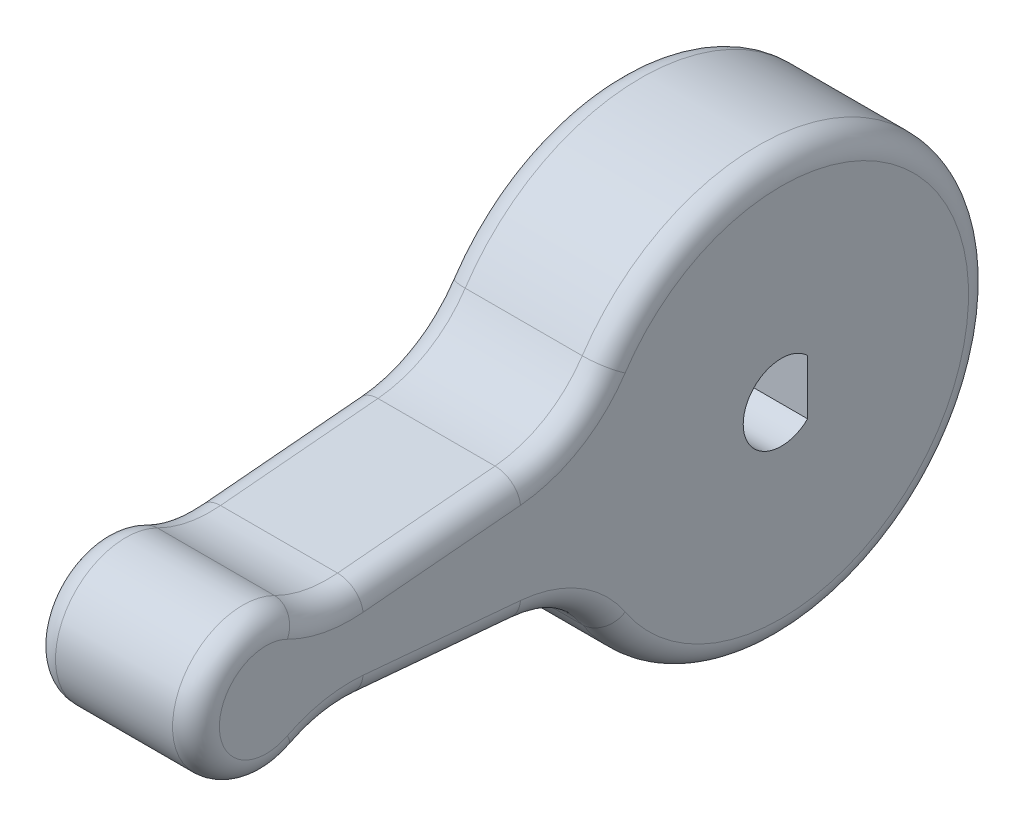
from build123d import *

# Parameters (mm, degrees)
BOSS_EXTRUDE1_DEPTH = 3.5
FILLET1_R           = 5
HOLE1_D             = 2.5
HOLE1_DEPTH         = 9
HOLE1_CBORE_D       = 3.5
HOLE1_CBORE_DEPTH   = 3
FILLET2_R           = 1


with BuildPart() as part:
    # Sketch1 → Boss-Extrude1 (new, symmetric)
    with BuildSketch(Plane(origin=(0, 0, 0), x_dir=(0, 0, -1), z_dir=(1, 0, 0))):
        with BuildLine():
            Line((-19.763932023, 2), (-8.485281374, 3))
            ThreePointArc((-8.485281374, 3), (9, 0), (-8.485281374, -3))
            Line((-8.485281374, -3), (-19.763932023, -2))
            ThreePointArc((-19.763932023, -2), (-25, 0), (-19.763932023, 2))
        make_face()
        with BuildLine():
            Line((1.125, -1.17260394), (1.125, 1.17260394))
            ThreePointArc((1.125, 1.17260394), (-1.625, 0), (1.125, -1.17260394))
        make_face(mode=Mode.SUBTRACT)
    extrude(amount=BOSS_EXTRUDE1_DEPTH, both=True)

    # Fillet1
    fillet1_edges = [part.edges().sort_by_distance(p)[0] for p in [
        (0, 2, 19.763932023),
        (0, 3, 8.485281374),
        (0, -3, 8.485281374),
        (0, -2, 19.763932023),
    ]]
    fillet(fillet1_edges, radius=FILLET1_R)

    # Hole1
    with Locations(Plane(origin=(0, 0, -9.125), x_dir=(1, 0, 0), z_dir=(0, 0, -1))):
        with Locations((0, 0)):
            CounterBoreHole(HOLE1_D / 2, HOLE1_CBORE_D / 2, HOLE1_CBORE_DEPTH, depth=HOLE1_DEPTH)

    # Fillet2
    fillet2_edges = [part.edges().sort_by_distance(p)[0] for p in [
        (-3.5, 0, 25),
        (3.5, 0, 25),
        (-3.5, 2.458817952, 14.589084631),
        (3.5, 2.458817952, 14.589084631),
        (-3.5, 0, -9),
        (3.5, 0, -9),
        (-3.5, -2.458817952, 14.589084631),
        (3.5, -2.458817952, 14.589084631),
        (-3.5, 2.230698388, 19.336127101),
        (3.5, 2.230698388, 19.336127101),
        (-3.5, -3.440789323, 9.110481838),
        (3.5, -3.440789323, 9.110481838),
        (-3.5, -2.230698388, 19.336127101),
        (3.5, -2.230698388, 19.336127101),
        (-3.5, 3.440789323, 9.110481838),
        (3.5, 3.440789323, 9.110481838),
    ]]
    fillet(fillet2_edges, radius=FILLET2_R)


solid = part.part
